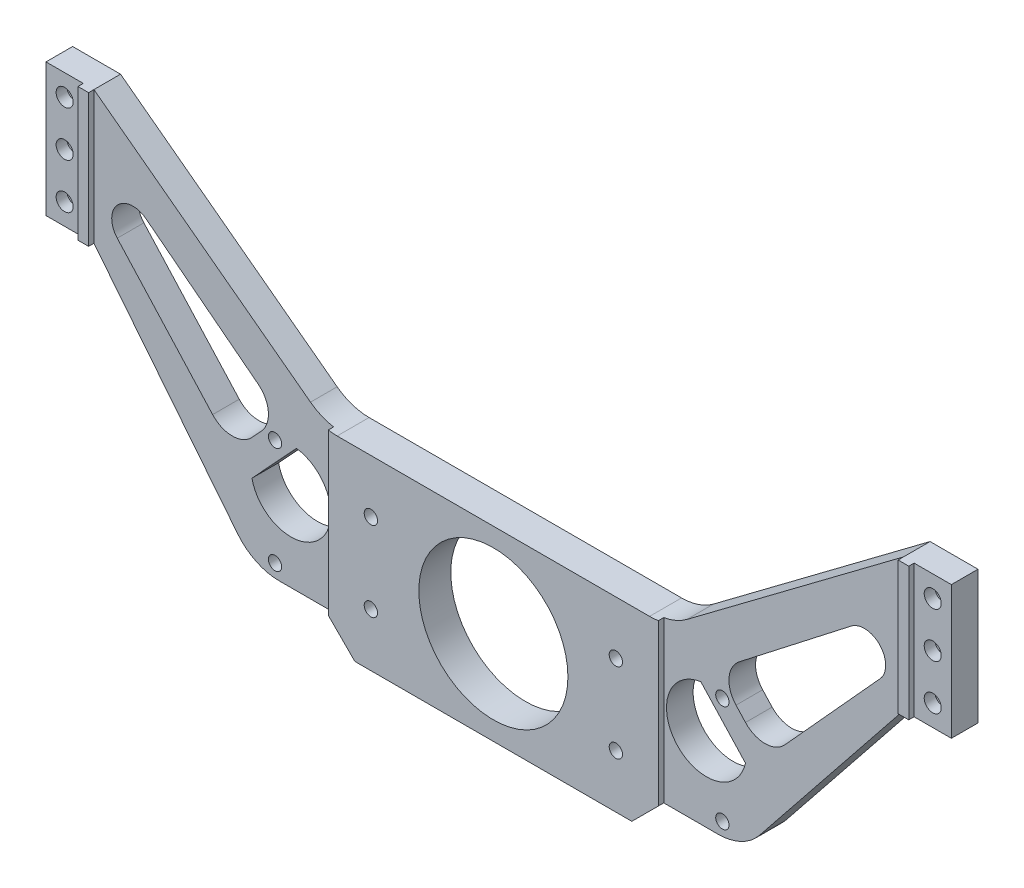
from build123d import *

# Parameters (mm, degrees)
SKETCH_1_R             = 14
EXTRUDE_1_DEPTH        = 5
SKETCH_2_W             = 2
SKETCH_2_H             = 25
EXTRUDE_2_DEPTH        = 1
CUT_EXTRUDE_2_REACH    = 100.742
HOLE_WIZARD_M3_1_D     = 2.5
HOLE_WIZARD_M3_1_DEPTH = 8.5
HOLE_WIZARD_M3_1_TIP   = 0.751075774
SKETCH_9_R             = 14
EXTRUDE_3_DEPTH        = 1
HOLE_WIZARD_M3_3_D     = 2.5
HOLE_WIZARD_M3_3_DEPTH = 8.5
HOLE_WIZARD_M3_3_TIP   = 0.751075774
CUT_EXTRUDE_3_REACH    = 100.742
SKETCH_12_R            = 1.6
SKETCH_13_R            = 3
CUT_EXTRUDE_4_DEPTH    = 3


with BuildPart() as part:
    # 草图1 → 凸台-拉伸1 (new body)
    with BuildSketch(Plane.XY):
        with BuildLine():
            Line((-85, 25), (-85, 50))
            Line((-85, 50), (-76, 50))
            Line((-76, 50), (-35.333333333, 19.5))
            ThreePointArc((-35.333333333, 19.5), (-32.495610994, 18.013167019), (-29.333333333, 17.5))
            Line((-29.333333333, 17.5), (29.333333333, 17.5))
            ThreePointArc((29.333333333, 17.5), (32.495610994, 18.013167019), (35.333333333, 19.5))
            Line((35.333333333, 19.5), (76, 50))
            Line((76, 50), (85, 50))
            Line((85, 50), (85, 25))
            Line((85, 25), (76, 25))
            Line((76, 25), (49.00243962, -8.746950476))
            ThreePointArc((49.00243962, -8.746950476), (45.52563883, -11.513032363), (41.193751525, -12.5))
            Line((41.193751525, -12.5), (31, -12.5))
            Line((31, -12.5), (26, -17.5))
            Line((26, -17.5), (-26, -17.5))
            Line((-26, -17.5), (-31, -12.5))
            Line((-31, -12.5), (-41.193751525, -12.5))
            ThreePointArc((-41.193751525, -12.5), (-45.52563883, -11.513032363), (-49.00243962, -8.746950476))
            Line((-49.00243962, -8.746950476), (-76, 25))
            Line((-76, 25), (-85, 25))
        make_face()
        Circle(SKETCH_1_R, mode=Mode.SUBTRACT)
    extrude(amount=EXTRUDE_1_DEPTH)

    # 草图2 → 凸台-拉伸2 (add)
    with BuildSketch(Plane.XY.offset(5)):
        with Locations((-77, 37.5)):
            Rectangle(SKETCH_2_W, SKETCH_2_H)
        with Locations((77, 37.5)):
            Rectangle(SKETCH_2_W, SKETCH_2_H)
    extrude(amount=EXTRUDE_2_DEPTH)

    # 草图3 → 切除-拉伸2 (cut, up to next)
    with BuildSketch(Plane.XY.offset(5), mode=Mode.PRIVATE) as cut_extrude_2_sk1:
        with BuildLine():
            Line((-71.624088, 28.017247632), (-53.714483662, 8.288938763))
            ThreePointArc((-53.714483662, 8.288938763), (-50.037049276, 6.649771189), (-46.343650352, 8.252643109))
            Line((-46.343650352, 8.252643109), (-44.561564605, 10.177266985))
            ThreePointArc((-44.561564605, 10.177266985), (-43.247059214, 13.982850984), (-45.163793368, 17.523546422))
            Line((-45.163793368, 17.523546422), (-66.209204362, 33.865234658))
            ThreePointArc((-66.209204362, 33.865234658), (-71.597466294, 33.423519047), (-71.624088, 28.017247632))
        make_face()
    cut_extrude_2_tool1 = extrude(cut_extrude_2_sk1.sketch, amount=-CUT_EXTRUDE_2_REACH, mode=Mode.PRIVATE) & part.part
    # 草图3 → 切除-拉伸2 (cut, up to next)
    with BuildSketch(Plane.XY.offset(5), mode=Mode.PRIVATE) as cut_extrude_2_sk2:
        with BuildLine():
            Line((44.878567193, 3.211549518), (46.335374238, 1.638221397))
            ThreePointArc((46.335374238, 1.638221397), (45.673933781, -0.192361307), (44.563707744, -1.791090382))
            ThreePointArc((44.563707744, -1.791090382), (33.507457779, -1.845533864), (34.410800923, 9.173885293))
            ThreePointArc((34.410800923, 9.173885293), (36.090068224, 10.158058978), (37.966040159, 10.676967267))
            Line((37.966040159, 10.676967267), (44.878567193, 3.211549518))
        make_face()
    cut_extrude_2_tool2 = extrude(cut_extrude_2_sk2.sketch, amount=-CUT_EXTRUDE_2_REACH, mode=Mode.PRIVATE) & part.part
    # 草图3 → 切除-拉伸2 (cut, up to next)
    with BuildSketch(Plane.XY.offset(5), mode=Mode.PRIVATE) as cut_extrude_2_sk3:
        with BuildLine():
            Line((-44.878567193, 3.211549518), (-46.335374238, 1.638221397))
            ThreePointArc((-46.335374238, 1.638221397), (-45.673933781, -0.192361307), (-44.563707744, -1.791090382))
            ThreePointArc((-44.563707744, -1.791090382), (-33.507457779, -1.845533864), (-34.410800923, 9.173885293))
            ThreePointArc((-34.410800923, 9.173885293), (-36.090068224, 10.158058978), (-37.966040159, 10.676967267))
            Line((-37.966040159, 10.676967267), (-44.878567193, 3.211549518))
        make_face()
    cut_extrude_2_tool3 = extrude(cut_extrude_2_sk3.sketch, amount=-CUT_EXTRUDE_2_REACH, mode=Mode.PRIVATE) & part.part
    # 草图3 → 切除-拉伸2 (cut, up to next)
    with BuildSketch(Plane.XY.offset(5), mode=Mode.PRIVATE) as cut_extrude_2_sk4:
        with BuildLine():
            Line((46.343650352, 8.252643109), (44.561564605, 10.177266985))
            ThreePointArc((44.561564605, 10.177266985), (43.247059214, 13.982850984), (45.163793368, 17.523546422))
            Line((45.163793368, 17.523546422), (66.209204362, 33.865234658))
            ThreePointArc((66.209204362, 33.865234658), (71.597466294, 33.423519047), (71.624088, 28.017247632))
            Line((71.624088, 28.017247632), (53.714483662, 8.288938763))
            ThreePointArc((53.714483662, 8.288938763), (50.037049276, 6.649771189), (46.343650352, 8.252643109))
        make_face()
    cut_extrude_2_tool4 = extrude(cut_extrude_2_sk4.sketch, amount=-CUT_EXTRUDE_2_REACH, mode=Mode.PRIVATE) & part.part
    add(cut_extrude_2_tool1.solids().sort_by_distance((-57.416432, 20.292736, 5))[0], mode=Mode.SUBTRACT)
    add(cut_extrude_2_tool2.solids().sort_by_distance((38.242863, 2.539166, 5))[0], mode=Mode.SUBTRACT)
    add(cut_extrude_2_tool3.solids().sort_by_distance((-38.242863, 2.539166, 5))[0], mode=Mode.SUBTRACT)
    add(cut_extrude_2_tool4.solids().sort_by_distance((57.416432, 20.292736, 5))[0], mode=Mode.SUBTRACT)

    # M3 螺纹孔1
    with Locations(Plane(origin=(-42, 10, 5), x_dir=(1, 0, 0), z_dir=(0, 0, 1))):
        with Locations((0, 0), (0, -20), (84, 0), (84, -20)):
            Hole(HOLE_WIZARD_M3_1_D / 2, depth=HOLE_WIZARD_M3_1_DEPTH)
            with Locations((0, 0, -(HOLE_WIZARD_M3_1_DEPTH + HOLE_WIZARD_M3_1_TIP / 2))):  # 118° drill point
                Cone(0, HOLE_WIZARD_M3_1_D / 2, HOLE_WIZARD_M3_1_TIP, mode=Mode.SUBTRACT)

    # 草图9 → 凸台-拉伸3 (add)
    with BuildSketch(Plane.XY.offset(5)):
        with BuildLine():
            Line((-31, -12.5), (-31, 17.639867028))
            ThreePointArc((-31, 17.639867028), (-30.169595936, 17.535028105), (-29.333333333, 17.5))
            Line((-29.333333333, 17.5), (29.333333333, 17.5))
            ThreePointArc((29.333333333, 17.5), (30.169595936, 17.535028105), (31, 17.639867028))
            Line((31, 17.639867028), (31, -12.5))
            Line((31, -12.5), (26, -17.5))
            Line((26, -17.5), (-26, -17.5))
            Line((-26, -17.5), (-31, -12.5))
        make_face()
        Circle(SKETCH_9_R, mode=Mode.SUBTRACT)
    extrude(amount=EXTRUDE_3_DEPTH)

    # M3 螺纹孔3
    with Locations(Plane(origin=(-23, 7.5, 6), x_dir=(1, 0, 0), z_dir=(0, 0, 1))):
        with Locations((0, 0), (0, -15), (46, -15), (46, 0)):
            Hole(HOLE_WIZARD_M3_3_D / 2, depth=HOLE_WIZARD_M3_3_DEPTH)
            with Locations((0, 0, -(HOLE_WIZARD_M3_3_DEPTH + HOLE_WIZARD_M3_3_TIP / 2))):  # 118° drill point
                Cone(0, HOLE_WIZARD_M3_3_D / 2, HOLE_WIZARD_M3_3_TIP, mode=Mode.SUBTRACT)

    # 草图12 → 切除-拉伸3 (cut, up to next)
    with BuildSketch(Plane.XY.offset(5), mode=Mode.PRIVATE) as cut_extrude_3_sk1:
        with Locations((-81.5, 37.5)):
            Circle(SKETCH_12_R)
    cut_extrude_3_tool1 = extrude(cut_extrude_3_sk1.sketch, amount=-CUT_EXTRUDE_3_REACH, mode=Mode.PRIVATE) & part.part
    # 草图12 → 切除-拉伸3 (cut, up to next)
    with BuildSketch(Plane.XY.offset(5), mode=Mode.PRIVATE) as cut_extrude_3_sk2:
        with Locations((-81.5, 29)):
            Circle(SKETCH_12_R)
    cut_extrude_3_tool2 = extrude(cut_extrude_3_sk2.sketch, amount=-CUT_EXTRUDE_3_REACH, mode=Mode.PRIVATE) & part.part
    # 草图12 → 切除-拉伸3 (cut, up to next)
    with BuildSketch(Plane.XY.offset(5), mode=Mode.PRIVATE) as cut_extrude_3_sk3:
        with Locations(Location((-81.5, 46, 0), (0, 0, 180))):
            Circle(SKETCH_12_R)
    cut_extrude_3_tool3 = extrude(cut_extrude_3_sk3.sketch, amount=-CUT_EXTRUDE_3_REACH, mode=Mode.PRIVATE) & part.part
    # 草图12 → 切除-拉伸3 (cut, up to next)
    with BuildSketch(Plane.XY.offset(5), mode=Mode.PRIVATE) as cut_extrude_3_sk4:
        with Locations((81.5, 46)):
            Circle(SKETCH_12_R)
    cut_extrude_3_tool4 = extrude(cut_extrude_3_sk4.sketch, amount=-CUT_EXTRUDE_3_REACH, mode=Mode.PRIVATE) & part.part
    # 草图12 → 切除-拉伸3 (cut, up to next)
    with BuildSketch(Plane.XY.offset(5), mode=Mode.PRIVATE) as cut_extrude_3_sk5:
        with Locations(Location((81.5, 29, 0), (0, 0, 180))):
            Circle(SKETCH_12_R)
    cut_extrude_3_tool5 = extrude(cut_extrude_3_sk5.sketch, amount=-CUT_EXTRUDE_3_REACH, mode=Mode.PRIVATE) & part.part
    # 草图12 → 切除-拉伸3 (cut, up to next)
    with BuildSketch(Plane.XY.offset(5), mode=Mode.PRIVATE) as cut_extrude_3_sk6:
        with Locations(Location((81.5, 37.5, 0), (0, 0, 180))):
            Circle(SKETCH_12_R)
    cut_extrude_3_tool6 = extrude(cut_extrude_3_sk6.sketch, amount=-CUT_EXTRUDE_3_REACH, mode=Mode.PRIVATE) & part.part
    add(cut_extrude_3_tool1.solids().sort_by_distance((-81.5, 37.5, 5))[0], mode=Mode.SUBTRACT)
    add(cut_extrude_3_tool2.solids().sort_by_distance((-81.5, 29, 5))[0], mode=Mode.SUBTRACT)
    add(cut_extrude_3_tool3.solids().sort_by_distance((-81.5, 46, 5))[0], mode=Mode.SUBTRACT)
    add(cut_extrude_3_tool4.solids().sort_by_distance((81.5, 46, 5))[0], mode=Mode.SUBTRACT)
    add(cut_extrude_3_tool5.solids().sort_by_distance((81.5, 29, 5))[0], mode=Mode.SUBTRACT)
    add(cut_extrude_3_tool6.solids().sort_by_distance((81.5, 37.5, 5))[0], mode=Mode.SUBTRACT)

    # 草图13 → 切除-拉伸4 (cut)
    with BuildSketch(Plane(origin=(0, 0, 0), x_dir=(-1, 0, 0), z_dir=(0, 0, -1))):
        with Locations((-81.5, 37.5)):
            Circle(SKETCH_13_R)
        with Locations((-81.5, 46)):
            Circle(SKETCH_13_R)
        with Locations((-81.5, 29)):
            Circle(SKETCH_13_R)
        with Locations(Location((81.5, 29, 0), (0, 0, 180))):
            Circle(SKETCH_13_R)
        with Locations(Location((81.5, 37.5, 0), (0, 0, 180))):
            Circle(SKETCH_13_R)
        with Locations(Location((81.5, 46, 0), (0, 0, 180))):
            Circle(SKETCH_13_R)
    extrude(amount=-CUT_EXTRUDE_4_DEPTH, mode=Mode.SUBTRACT)


solid = part.part
